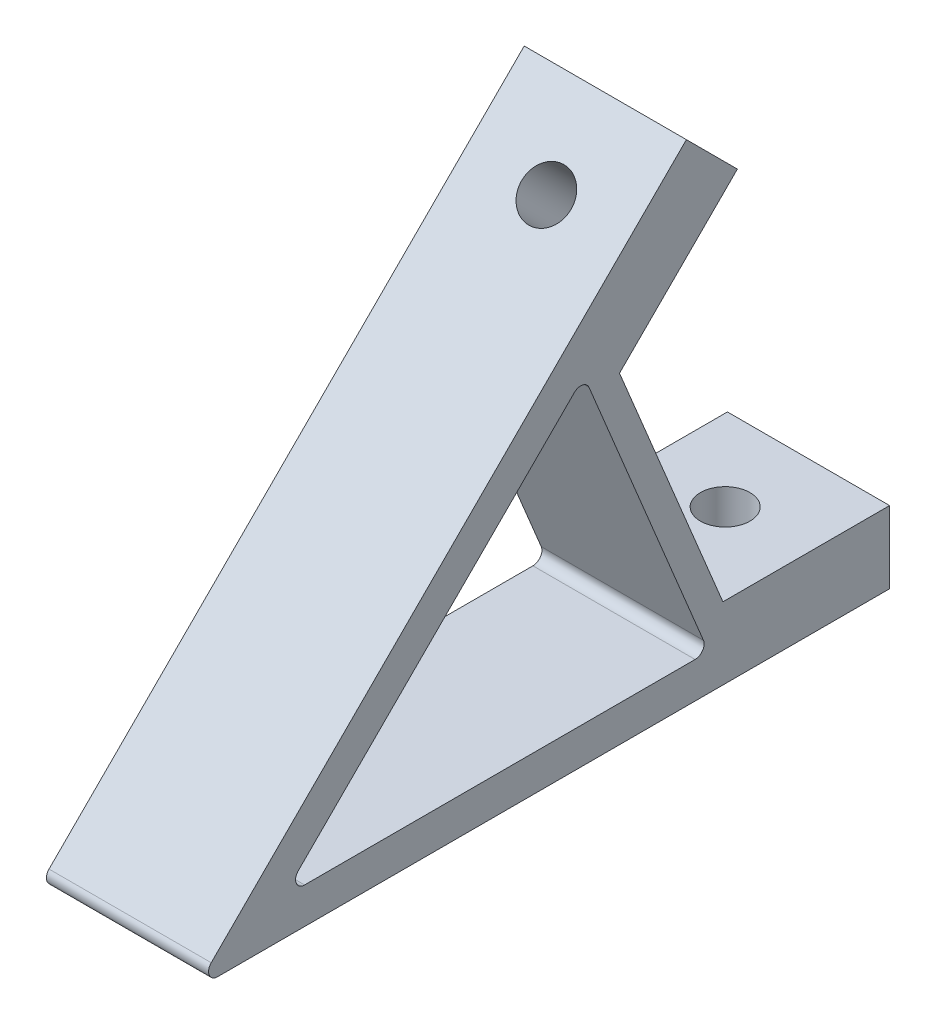
from build123d import *

# Parameters (mm, degrees)
EXTRUDE_2_DEPTH     = 18
FILLET_2_R          = 1
CUT_EXTRUDE_1_REACH = 93.708
SKETCH_2_R          = 2.75
CUT_EXTRUDE_2_REACH = 97.007
SKETCH_3_R          = 2.75


with BuildPart() as part:
    # 草图1 → 凸台-拉伸2 (new body)
    with BuildSketch(Plane(origin=(0, 0, 0), x_dir=(0, 0, -1), z_dir=(1, 0, 0))):
        Polygon((77, 0), (0, 0), (54.447222151, 54.447222151), (60.104076401, 48.790367902), (47.022600949, 35.70889245), (58.5, 8), (77, 8), align=None)
        Polygon((9.656854249, 4), (56.909677649, 4), (43.069646105, 37.412791856), align=None, mode=Mode.SUBTRACT)
    extrude(amount=EXTRUDE_2_DEPTH)

    # 圆角2
    fillet_2_edges = [part.edges().sort_by_distance(p)[0] for p in [
        (9, 0, 0),
        (9, 37.412791856, -43.069646105),
        (9, 4, -9.656854249),
        (9, 4, -56.909677649),
    ]]
    fillet(fillet_2_edges, radius=FILLET_2_R)

    # 草图2 → 切除-拉伸1 (cut, up to next)
    with BuildSketch(Plane(origin=(0, 8, 0), x_dir=(1, 0, 0), z_dir=(0, 1, 0)), mode=Mode.PRIVATE) as cut_extrude_1_sk1:
        with Locations(Location((9, 67.75, 0), (0, 0, 270))):
            Circle(SKETCH_2_R)
    cut_extrude_1_tool1 = extrude(cut_extrude_1_sk1.sketch, amount=-CUT_EXTRUDE_1_REACH, mode=Mode.PRIVATE) & part.part
    add(cut_extrude_1_tool1.solids().sort_by_distance((9, 8, -67.75))[0], mode=Mode.SUBTRACT)

    # 草图3 → 切除-拉伸2 (cut, up to next)
    with BuildSketch(Plane(origin=(0, -5.656854249, -5.656854249), x_dir=(1, 0, 0), z_dir=(0, -0.7071067811865509, -0.7071067811865441)), mode=Mode.PRIVATE) as cut_extrude_2_sk1:
        with Locations(Location((9, -67.75, 0), (0, 0, 270))):
            Circle(SKETCH_3_R)
    cut_extrude_2_tool1 = extrude(cut_extrude_2_sk1.sketch, amount=-CUT_EXTRUDE_2_REACH, mode=Mode.PRIVATE) & part.part
    add(cut_extrude_2_tool1.solids().sort_by_distance((9, 42.24963, -53.563339))[0], mode=Mode.SUBTRACT)


solid = part.part
